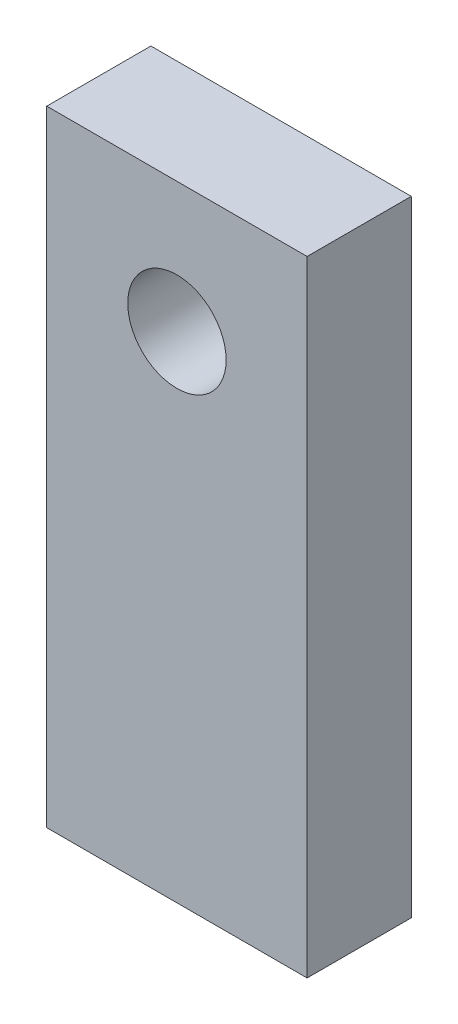
from build123d import *

# Parameters (mm, degrees)
SKETCH1_W                = 6.35
SKETCH1_H                = 15.24
BOSS_EXTRUDE1_DEPTH      = 2.54
M2_CLEARANCE_HOLE1_D     = 2.4
M2_CLEARANCE_HOLE1_DEPTH = 10
M2_CLEARANCE_HOLE1_TIP   = 0.721032743


with BuildPart() as part:
    # Sketch1 → Boss-Extrude1 (new body)
    with BuildSketch(Plane.XY):
        with Locations((3.175, 7.62)):
            Rectangle(SKETCH1_W, SKETCH1_H)
    extrude(amount=BOSS_EXTRUDE1_DEPTH)

    # M2 Clearance Hole1
    with Locations(Plane(origin=(3.175, 12.065, 2.54), x_dir=(1, 0, 0), z_dir=(0, 0, 1))):
        with Locations((0, 0)):
            Hole(M2_CLEARANCE_HOLE1_D / 2, depth=M2_CLEARANCE_HOLE1_DEPTH)
            with Locations((0, 0, -(M2_CLEARANCE_HOLE1_DEPTH + M2_CLEARANCE_HOLE1_TIP / 2))):  # 118° drill point
                Cone(0, M2_CLEARANCE_HOLE1_D / 2, M2_CLEARANCE_HOLE1_TIP, mode=Mode.SUBTRACT)


solid = part.part
